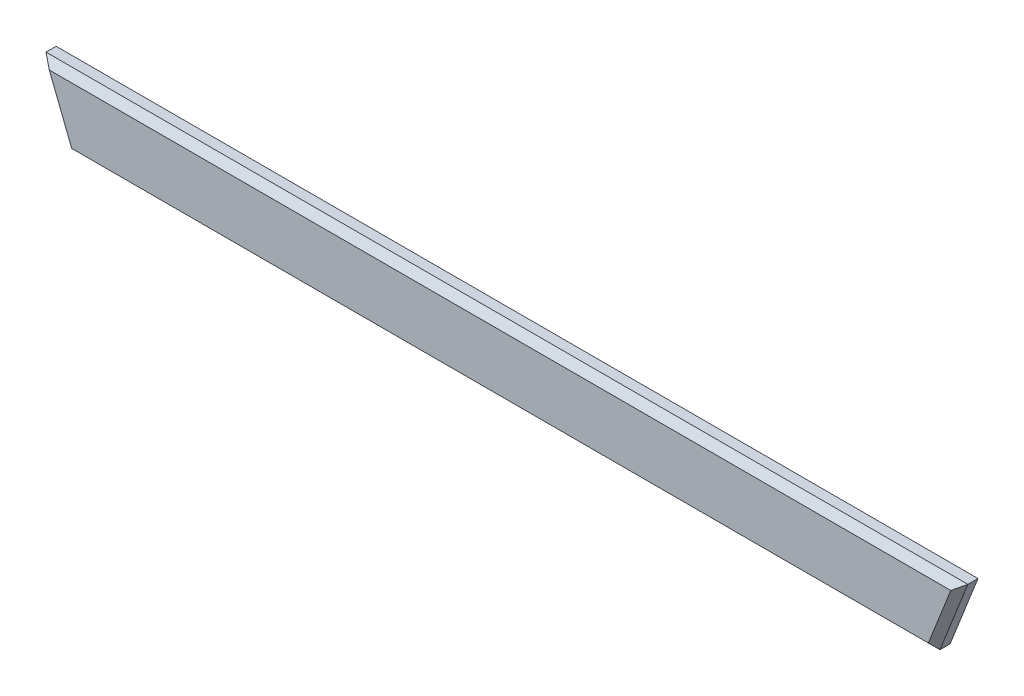
from build123d import *

# Parameters (mm, degrees)
BOSS_EXTRUDE1_DEPTH           = 3.7
CHAMFER1_SIZE                 = 1.5
SKETCH2_R                     = 3
BOSS_EXTRUDE2_DEPTH           = 3
BOSS_EXTRUDE2_DRAFT           = 10
BOSS_EXTRUDE2_PROFILE_2_DEPTH = 3
BOSS_EXTRUDE2_PROFILE_2_DRAFT = 10
BOSS_EXTRUDE2_PROFILE_3_DEPTH = 3
BOSS_EXTRUDE2_PROFILE_3_DRAFT = 10


with BuildPart() as part:
    # Sketch1 → Boss-Extrude1 (new body)
    with BuildSketch(Plane.XY):
        Polygon((100, 7.893729842), (-100, 7.893729842), (-93.951405808, -7.416270158), (93.951405808, -7.416270158), align=None)
    extrude(amount=BOSS_EXTRUDE1_DEPTH)

    # Chamfer1
    chamfer1_edges = [part.edges().sort_by_distance(p)[0] for p in [
        (0, 7.893729842, 3.7),
        (-96.975702904, 0.238729842, 3.7),
        (0, -7.416270158, 3.7),
        (96.975702904, 0.238729842, 3.7),
    ]]
    chamfer(chamfer1_edges, length=CHAMFER1_SIZE)


with BuildPart() as boss_extrude2_tool:
    # Sketch2 → Boss-Extrude2 (with draft: the straight prism first)
    with BuildSketch(Plane(origin=(0, 0, 0), x_dir=(-1, 0, 0), z_dir=(0, 0, -1))):
        with Locations((-69.740425787, 1.006073404)):
            Circle(SKETCH2_R)
    extrude(amount=BOSS_EXTRUDE2_DEPTH)
    # Boss-Extrude2: the draft: its side faces are tilted about the plane it starts from
    boss_extrude2_sides = [boss_extrude2_tool.faces().sort_by_distance(p)[0] for p in [
        (72.740425787, 1.006073404, -1.5),
    ]]
    draft(boss_extrude2_sides, Plane(origin=(0, 0, 0), x_dir=(-1, 0, 0), z_dir=(0, 0, -1)), BOSS_EXTRUDE2_DRAFT)


with BuildPart() as part_1:
    add(part.part)

    # Boss-Extrude2: add boss_extrude2_tool
    add(boss_extrude2_tool.part)


with BuildPart() as boss_extrude2_profile_2_tool:
    # Sketch2 → Boss-Extrude2 profile 2 (with draft: the straight prism first)
    with BuildSketch(Plane(origin=(0, 0, 0), x_dir=(-1, 0, 0), z_dir=(0, 0, -1))):
        with Locations((0.259574213, 1.006073404)):
            Circle(SKETCH2_R)
    extrude(amount=BOSS_EXTRUDE2_PROFILE_2_DEPTH)
    # Boss-Extrude2 profile 2: the draft: its side faces are tilted about the plane it starts from
    boss_extrude2_profile_2_sides = [boss_extrude2_profile_2_tool.faces().sort_by_distance(p)[0] for p in [
        (2.740425787, 1.006073404, -1.5),
    ]]
    draft(boss_extrude2_profile_2_sides, Plane(origin=(0, 0, 0), x_dir=(-1, 0, 0), z_dir=(0, 0, -1)), BOSS_EXTRUDE2_PROFILE_2_DRAFT)


with BuildPart() as part_2:
    add(part_1.part)

    # Boss-Extrude2 profile 2: add boss_extrude2_profile_2_tool
    add(boss_extrude2_profile_2_tool.part)


with BuildPart() as boss_extrude2_profile_3_tool:
    # Sketch2 → Boss-Extrude2 profile 3 (with draft: the straight prism first)
    with BuildSketch(Plane(origin=(0, 0, 0), x_dir=(-1, 0, 0), z_dir=(0, 0, -1))):
        with Locations((70.259574213, 1.006073404)):
            Circle(SKETCH2_R)
    extrude(amount=BOSS_EXTRUDE2_PROFILE_3_DEPTH)
    # Boss-Extrude2 profile 3: the draft: its side faces are tilted about the plane it starts from
    boss_extrude2_profile_3_sides = [boss_extrude2_profile_3_tool.faces().sort_by_distance(p)[0] for p in [
        (-67.259574213, 1.006073404, -1.5),
    ]]
    draft(boss_extrude2_profile_3_sides, Plane(origin=(0, 0, 0), x_dir=(-1, 0, 0), z_dir=(0, 0, -1)), BOSS_EXTRUDE2_PROFILE_3_DRAFT)


with BuildPart() as part_3:
    add(part_2.part)

    # Boss-Extrude2 profile 3: add boss_extrude2_profile_3_tool
    add(boss_extrude2_profile_3_tool.part)


solid = part_3.part
